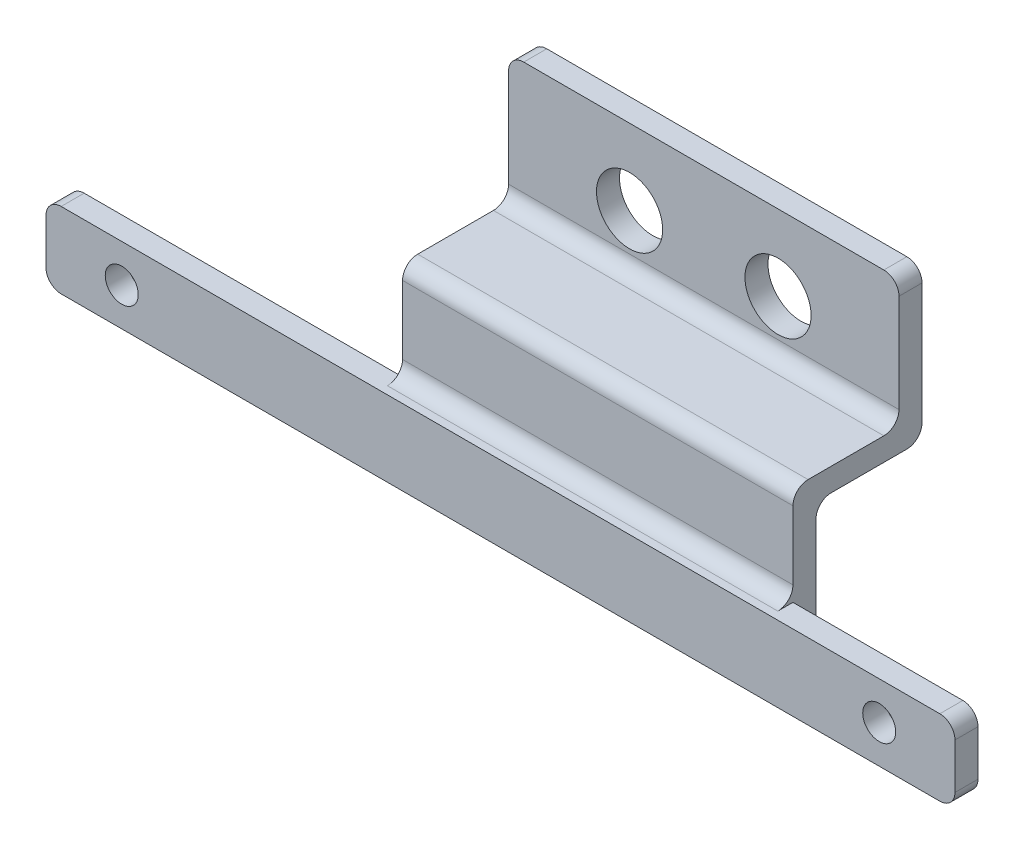
from build123d import *

# Parameters (mm, degrees)
SKETCH1_W           = 25.77
SKETCH1_H           = 10
SKETCH1_R           = 2.185
BOSS_EXTRUDE1_DEPTH = 1.52
SKETCH2_W           = 25.77
SKETCH2_H           = 1.52
BOSS_EXTRUDE2_DEPTH = 7
SKETCH3_W           = 25.77
SKETCH3_H           = 1.52
BOSS_EXTRUDE3_DEPTH = 10
BOSS_EXTRUDE4_DEPTH = 1.52
SKETCH5_R           = 1.09
CUT_EXTRUDE1_DEPTH  = 5
FILLET1_R           = 1


with BuildPart() as part:
    # Sketch1 → Boss-Extrude1 (new body)
    with BuildSketch(Plane.XY):
        Rectangle(SKETCH1_W, SKETCH1_H)
        with Locations((-4.9, 0)):
            Circle(SKETCH1_R, mode=Mode.SUBTRACT)
        with Locations((4.9, 0)):
            Circle(SKETCH1_R, mode=Mode.SUBTRACT)
    extrude(amount=BOSS_EXTRUDE1_DEPTH)

    # Sketch2 → Boss-Extrude2 (add)
    with BuildSketch(Plane.XY.offset(1.52)):
        with Locations((0, -4.24)):
            Rectangle(SKETCH2_W, SKETCH2_H)
    extrude(amount=BOSS_EXTRUDE2_DEPTH)

    # Sketch3 → Boss-Extrude3 (add)
    with BuildSketch(Plane(origin=(0, -5, 0), x_dir=(-1, 0, 0), z_dir=(0, -1, 0))):
        with Locations((0, -7.76)):
            Rectangle(SKETCH3_W, SKETCH3_H)
    extrude(amount=BOSS_EXTRUDE3_DEPTH)

    # Sketch4 → Boss-Extrude4 (add)
    with BuildSketch(Plane.XY.offset(8.52)):
        Polygon((-12.885, -15), (-34.9, -15), (-34.9, -10), (25.1, -10), (25.1, -15), align=None)
    extrude(amount=BOSS_EXTRUDE4_DEPTH)

    # Sketch5 → Cut-Extrude1 (cut, symmetric)
    with BuildSketch(Plane.XY.offset(8.52)):
        with Locations(Location((-29.9, -12.5, 0), (0, 0, 180))):
            Circle(SKETCH5_R)
        with Locations(Location((20.1, -12.5, 0), (0, 0, 180))):
            Circle(SKETCH5_R)
    extrude(amount=CUT_EXTRUDE1_DEPTH, both=True, mode=Mode.SUBTRACT)

    # Fillet1
    fillet1_edges = [part.edges().sort_by_distance(p)[0] for p in [
        (0, -3.48, 8.52),
        (0, -10, 8.52),
        (25.1, -15, 9.28),
        (25.1, -10, 9.28),
        (-34.9, -15, 9.28),
        (-34.9, -10, 9.28),
        (0, -5, 7),
        (0, -5, 0),
        (0, -3.48, 1.52),
        (-12.885, 5, 0.76),
        (12.885, 5, 0.76),
        (0, -15, 7),
    ]]
    fillet(fillet1_edges, radius=FILLET1_R)


solid = part.part
